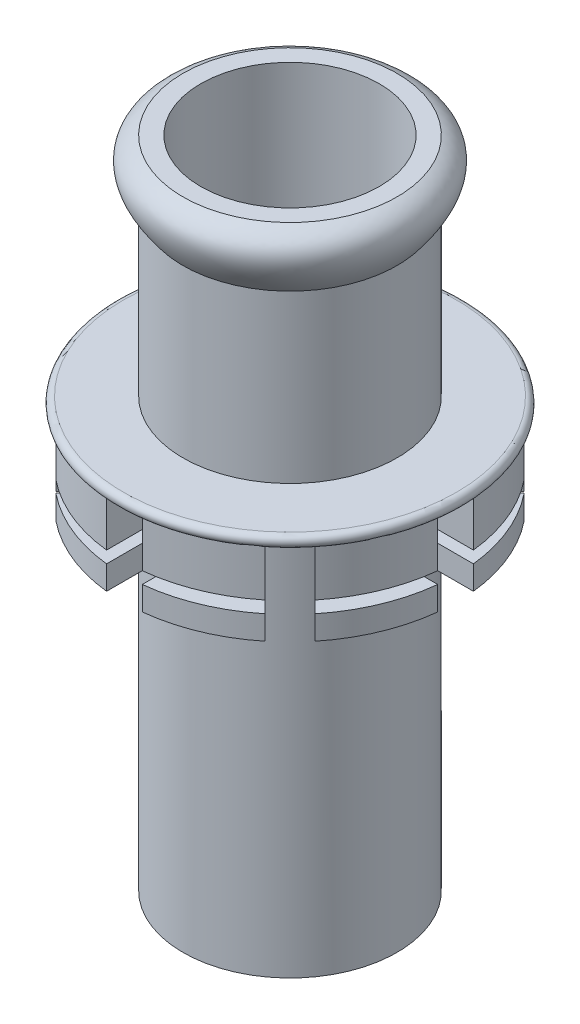
from build123d import *

# Parameters (mm, degrees)
TAGLIO_ESTRUSIONE1_START = -7
TAGLIO_ESTRUSIONE1_DEPTH = 7


with BuildPart() as part:
    # Schizzo2 → Rivoluzione1 (revolve)
    with BuildSketch(Plane.XY):
        with BuildLine():
            Line((-9, -21.170817104), (-9, -7.170817104))
            add(Edge.make_bspline(
                [(-9, -2.170817104), (-11.983123447, -3.356989604), (-9, -7.170817104)],
                knots=[0, 0, 0, 1, 1, 1], degree=2))
            Line((-9, -2.170817104), (-7.5, -2.170817104))
            Line((-7.5, -2.170817104), (-7.5, -29.670817104))
            Line((-7.5, -29.670817104), (-6, -29.670817104))
            Line((-6, -29.670817104), (-6, -57.170817104))
            Line((-6, -57.170817104), (-9, -57.170817104))
            Line((-9, -57.170817104), (-9, -29.170817104))
            Line((-9, -29.170817104), (-14, -29.170817104))
            Line((-14, -29.170817104), (-14, -27.170817104))
            Line((-14, -27.170817104), (-10, -27.170817104))
            Line((-10, -27.170817104), (-10, -26.170817104))
            Line((-10, -26.170817104), (-14, -26.170817104))
            Line((-14, -26.170817104), (-14, -22.170817104))
            ThreePointArc((-14, -22.170817104), (-14.5, -21.670817104), (-14, -21.170817104))
            Line((-14, -21.170817104), (-9, -21.170817104))
        make_face()
    revolve(axis=Axis((0, 18.35883479, 0), (0, -1, 0)))

    # Schizzo5 → Taglio-Estrusione1 (cut)
    with BuildSketch(Plane.XZ.offset(29.170817104).offset(TAGLIO_ESTRUSIONE1_START)):
        with BuildLine():
            Line((1.5, 15.062469538), (-1.5, 15.062469538))
            Line((-1.5, 15.062469538), (-1.5, 8.874119675))
            ThreePointArc((-1.5, 8.874119675), (0, 9), (1.5, 8.874119675))
            Line((1.5, 8.874119675), (1.5, 15.062469538))
        make_face()
        with BuildLine():
            Line((11.711434524, 9.59011418), (7.335610371, 5.214290027))
            ThreePointArc((7.335610371, 5.214290027), (6.363961031, 6.363961031), (5.214290027, 7.335610371))
            Line((5.214290027, 7.335610371), (9.59011418, 11.711434524))
            Line((9.59011418, 11.711434524), (11.711434524, 9.59011418))
        make_face()
        with BuildLine():
            Line((15.062469538, -1.5), (8.874119675, -1.5))
            ThreePointArc((8.874119675, -1.5), (9, 0), (8.874119675, 1.5))
            Line((8.874119675, 1.5), (15.062469538, 1.5))
            Line((15.062469538, 1.5), (15.062469538, -1.5))
        make_face()
        with BuildLine():
            Line((9.59011418, -11.711434524), (5.214290027, -7.335610371))
            ThreePointArc((5.214290027, -7.335610371), (6.363961031, -6.363961031), (7.335610371, -5.214290027))
            Line((7.335610371, -5.214290027), (11.711434524, -9.59011418))
            Line((11.711434524, -9.59011418), (9.59011418, -11.711434524))
        make_face()
        with BuildLine():
            Line((-1.5, -15.062469538), (-1.5, -8.874119675))
            ThreePointArc((-1.5, -8.874119675), (0, -9), (1.5, -8.874119675))
            Line((1.5, -8.874119675), (1.5, -15.062469538))
            Line((1.5, -15.062469538), (-1.5, -15.062469538))
        make_face()
        with BuildLine():
            Line((-11.711434524, -9.59011418), (-7.335610371, -5.214290027))
            ThreePointArc((-7.335610371, -5.214290027), (-6.363961031, -6.363961031), (-5.214290027, -7.335610371))
            Line((-5.214290027, -7.335610371), (-9.59011418, -11.711434524))
            Line((-9.59011418, -11.711434524), (-11.711434524, -9.59011418))
        make_face()
        with BuildLine():
            Line((-15.062469538, 1.5), (-8.874119675, 1.5))
            ThreePointArc((-8.874119675, 1.5), (-9, 0), (-8.874119675, -1.5))
            Line((-8.874119675, -1.5), (-15.062469538, -1.5))
            Line((-15.062469538, -1.5), (-15.062469538, 1.5))
        make_face()
        with BuildLine():
            Line((-9.59011418, 11.711434524), (-5.214290027, 7.335610371))
            ThreePointArc((-5.214290027, 7.335610371), (-6.363961031, 6.363961031), (-7.335610371, 5.214290027))
            Line((-7.335610371, 5.214290027), (-11.711434524, 9.59011418))
            Line((-11.711434524, 9.59011418), (-9.59011418, 11.711434524))
        make_face()
    extrude(amount=TAGLIO_ESTRUSIONE1_DEPTH, mode=Mode.SUBTRACT)


solid = part.part
